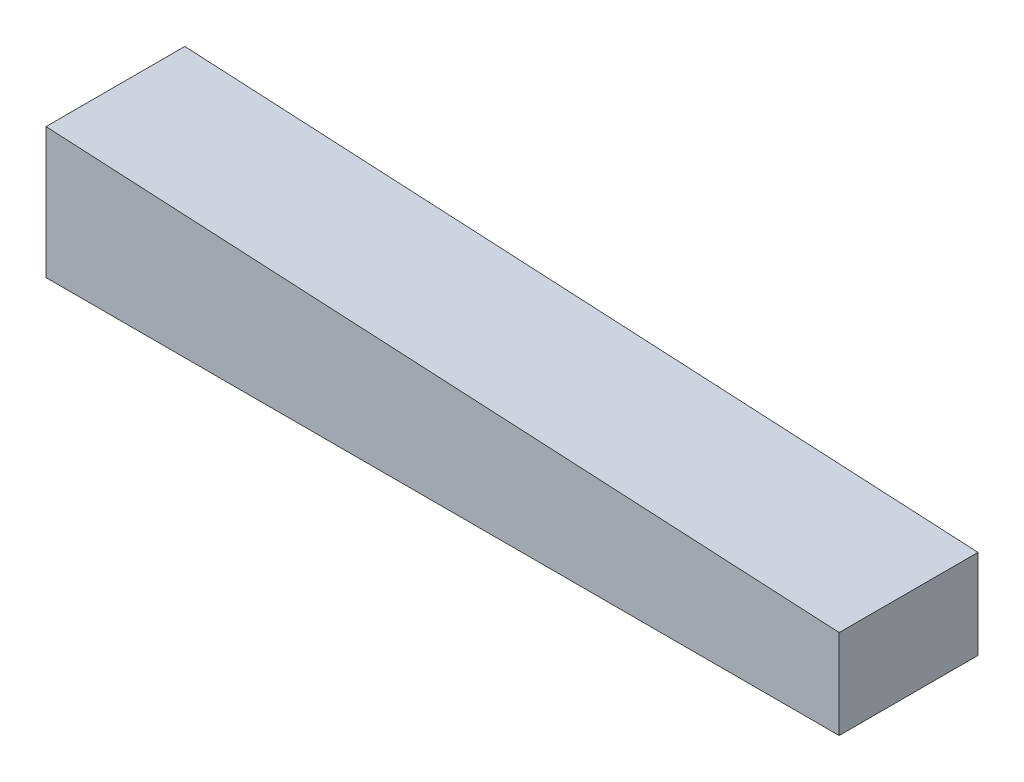
from build123d import *

# Parameters (mm, degrees)
SKETCH1_W           = 80
SKETCH1_H           = 9
BOSS_EXTRUDE1_DEPTH = 14
DRAFT1_ANGLE        = 3


with BuildPart() as part:
    # Sketch1 → Boss-Extrude1 (new body)
    with BuildSketch(Plane.XY):
        with Locations((40, 4.5)):
            Rectangle(SKETCH1_W, SKETCH1_H)
    extrude(amount=-BOSS_EXTRUDE1_DEPTH)

    # Draft1
    draft1_faces = [part.faces().sort_by_distance(p)[0] for p in [
        (40, 9, -7),
    ]]
    draft(draft1_faces, Plane(origin=(80, 0, -14), x_dir=(0, 0, 1), z_dir=(1, 0, 0)), DRAFT1_ANGLE)


solid = part.part
